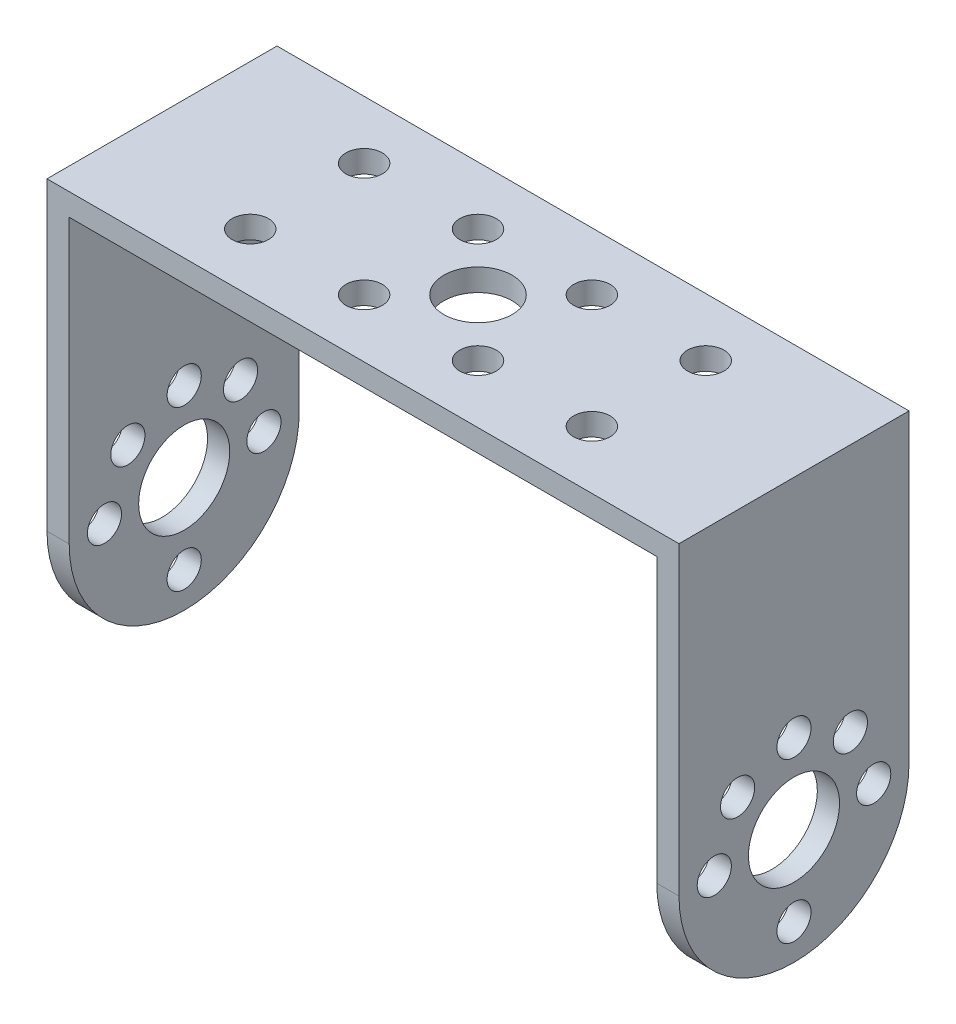
from build123d import *

# Parameters (mm, degrees)
BOSS_EXTRU_1_DEPTH      = 10.1
ENL_V_MAT_EXTRU_2_DEPTH = 68.408233918
ESQUISSE3_R             = 3
ESQUISSE3_R_2           = 1.6
ENL_V_MAT_EXTRU_1_DEPTH = 48.261850366
ESQUISSE5_R             = 4
ESQUISSE5_R_2           = 1.5
ENL_V_MAT_EXTRU_3_DEPTH = 68.408233918


with BuildPart() as part:
    # Esquisse1 → Boss.-Extru.1 (new, symmetric)
    with BuildSketch(Plane.XY):
        Polygon((-27.75, 36.9), (27.75, 36.9), (27.75, 0), (25.8, 0), (25.8, 34.95), (-25.8, 34.95), (-25.8, 0), (-27.75, 0), align=None)
    extrude(amount=BOSS_EXTRU_1_DEPTH, both=True)

    # Esquisse4 → Enlèv. mat.-Extru.2 (cut, through all)
    with BuildSketch(Plane(origin=(27.75, 0, 0), x_dir=(0, 0, -1), z_dir=(1, 0, 0))):
        with BuildLine():
            ThreePointArc((0, 0), (-7.14177849, 2.95822151), (-10.1, 10.1))
            Line((-10.1, 10.1), (-10.1, 0))
            Line((-10.1, 0), (0, 0))
        make_face()
        with BuildLine():
            ThreePointArc((10.1, 10.1), (7.14177849, 2.95822151), (0, 0))
            Line((0, 0), (10.1, 0))
            Line((10.1, 0), (10.1, 10.1))
        make_face()
    extrude(amount=-ENL_V_MAT_EXTRU_2_DEPTH, mode=Mode.SUBTRACT)

    # Esquisse3 → Enlèv. mat.-Extru.1 (cut, through all)
    with BuildSketch(Plane(origin=(0, 36.9, 0), x_dir=(1, 0, 0), z_dir=(0, 1, 0))):
        with Locations(Location((0, 0, 0), (0, 0, 270))):
            Circle(ESQUISSE3_R)
        with Locations(Location((-5, 5, 0), (0, 0, 270))):
            Circle(ESQUISSE3_R_2)
        with Locations(Location((-5, -5, 0), (0, 0, 270))):
            Circle(ESQUISSE3_R_2)
        with Locations(Location((5, -5, 0), (0, 0, 270))):
            Circle(ESQUISSE3_R_2)
        with Locations(Location((5, 5, 0), (0, 0, 270))):
            Circle(ESQUISSE3_R_2)
        with Locations(Location((-15, 5, 0), (0, 0, 270))):
            Circle(ESQUISSE3_R_2)
        with Locations(Location((-15, -5, 0), (0, 0, 270))):
            Circle(ESQUISSE3_R_2)
        with Locations(Location((15, -5, 0), (0, 0, 270))):
            Circle(ESQUISSE3_R_2)
        with Locations(Location((15, 5, 0), (0, 0, 270))):
            Circle(ESQUISSE3_R_2)
    extrude(amount=-ENL_V_MAT_EXTRU_1_DEPTH, mode=Mode.SUBTRACT)

    # Esquisse5 → Enlèv. mat.-Extru.3 (cut, through all)
    with BuildSketch(Plane(origin=(27.75, 0, 0), x_dir=(0, 0, -1), z_dir=(1, 0, 0))):
        with Locations(Location((0, 10.1, 0), (0, 0, 90))):
            Circle(ESQUISSE5_R)
        with Locations(Location((-7, 10.1, 0), (0, 0, 90))):
            Circle(ESQUISSE5_R_2)
        with Locations(Location((-4.949747468, 15.049747468, 0), (0, 0, 90))):
            Circle(ESQUISSE5_R_2)
        with Locations(Location((0, 17.1, 0), (0, 0, 90))):
            Circle(ESQUISSE5_R_2)
        with Locations(Location((0, 3.1, 0), (0, 0, 90))):
            Circle(ESQUISSE5_R_2)
        with Locations(Location((7, 10.1, 0), (0, 0, 270))):
            Circle(ESQUISSE5_R_2)
        with Locations(Location((4.949747468, 15.049747468, 0), (0, 0, 270))):
            Circle(ESQUISSE5_R_2)
    extrude(amount=-ENL_V_MAT_EXTRU_3_DEPTH, mode=Mode.SUBTRACT)


solid = part.part
